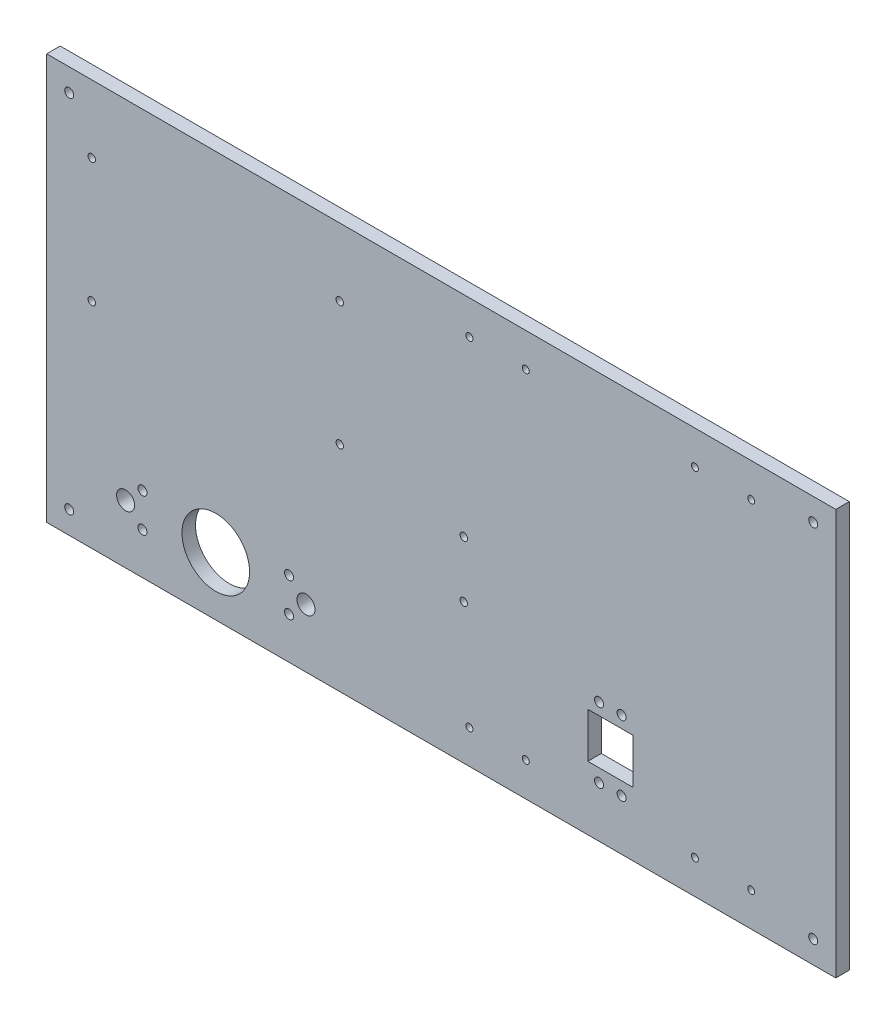
from build123d import *

# Parameters (mm, degrees)
ESBO_O1_W                = 350
ESBO_O1_H                = 180
ESBO_O1_R                = 2
ESBO_O1_R_2              = 15
ESBO_O1_R_3              = 4
ESBO_O1_R_4              = 1.65
ESBO_O1_W_2              = 20
ESBO_O1_H_2              = 20
RESSALTO_EXTRUS_O1_DEPTH = 6
ESBO_O2_R                = 2
CORTE_EXTRUS_O1_DEPTH    = 10
ESBO_O3_R                = 2
CORTE_EXTRUS_O2_DEPTH    = 10
ESBO_O4_R                = 1.55
CORTE_EXTRUS_O3_DEPTH    = 10


with BuildPart() as part:
    # Esboço1 → Ressalto-extrusão1 (new body)
    with BuildSketch(Plane.XY):
        Rectangle(ESBO_O1_W, ESBO_O1_H)
        with Locations((-132.5, -56.5)):
            Circle(ESBO_O1_R, mode=Mode.SUBTRACT)
        with Locations((-67.5, -56.5)):
            Circle(ESBO_O1_R, mode=Mode.SUBTRACT)
        with Locations((-100, -64)):
            Circle(ESBO_O1_R_2, mode=Mode.SUBTRACT)
        with Locations((-60, -64)):
            Circle(ESBO_O1_R_3, mode=Mode.SUBTRACT)
        with Locations((-140, -64)):
            Circle(ESBO_O1_R_3, mode=Mode.SUBTRACT)
        with Locations((-67.5, -71.5)):
            Circle(ESBO_O1_R, mode=Mode.SUBTRACT)
        with Locations((-132.5, -71.5)):
            Circle(ESBO_O1_R, mode=Mode.SUBTRACT)
        with Locations((10, -3)):
            Circle(ESBO_O1_R_4, mode=Mode.SUBTRACT)
        with Locations((10, -28)):
            Circle(ESBO_O1_R_4, mode=Mode.SUBTRACT)
        with Locations((-155, 60)):
            Circle(ESBO_O1_R_4, mode=Mode.SUBTRACT)
        with Locations((-45, 60)):
            Circle(ESBO_O1_R_4, mode=Mode.SUBTRACT)
        with Locations((-45, 5)):
            Circle(ESBO_O1_R_4, mode=Mode.SUBTRACT)
        with Locations((-155, 5)):
            Circle(ESBO_O1_R_4, mode=Mode.SUBTRACT)
        with Locations((75, -51.75)):
            Rectangle(ESBO_O1_W_2, ESBO_O1_H_2, mode=Mode.SUBTRACT)
    extrude(amount=RESSALTO_EXTRUS_O1_DEPTH)

    # Esboço2 → Corte-extrusão1 (cut)
    with BuildSketch(Plane.XY.offset(6)):
        with Locations((-165, 80)):
            Circle(ESBO_O2_R)
        with Locations((165, 80)):
            Circle(ESBO_O2_R)
        with Locations((165, -80)):
            Circle(ESBO_O2_R)
        with Locations((-165, -80)):
            Circle(ESBO_O2_R)
    extrude(amount=-CORTE_EXTRUS_O1_DEPTH, mode=Mode.SUBTRACT)

    # Esboço3 → Corte-extrusão2 (cut)
    with BuildSketch(Plane.XY.offset(6)):
        with Locations((80, -67.5)):
            Circle(ESBO_O3_R)
        with Locations((80, -36.5)):
            Circle(ESBO_O3_R)
        with Locations((70, -36.5)):
            Circle(ESBO_O3_R)
        with Locations((70, -67.5)):
            Circle(ESBO_O3_R)
    extrude(amount=-CORTE_EXTRUS_O2_DEPTH, mode=Mode.SUBTRACT)

    # Esboço4 → Corte-extrusão3 (cut)
    with BuildSketch(Plane.XY.offset(6)):
        with Locations((112.5, 75)):
            Circle(ESBO_O4_R)
        with Locations((137.5, 75)):
            Circle(ESBO_O4_R)
        with Locations((12.5, 75)):
            Circle(ESBO_O4_R)
        with Locations((37.5, 75)):
            Circle(ESBO_O4_R)
        with Locations((137.5, -75)):
            Circle(ESBO_O4_R)
        with Locations((112.5, -75)):
            Circle(ESBO_O4_R)
        with Locations((12.5, -75)):
            Circle(ESBO_O4_R)
        with Locations((37.5, -75)):
            Circle(ESBO_O4_R)
    extrude(amount=-CORTE_EXTRUS_O3_DEPTH, mode=Mode.SUBTRACT)


solid = part.part
